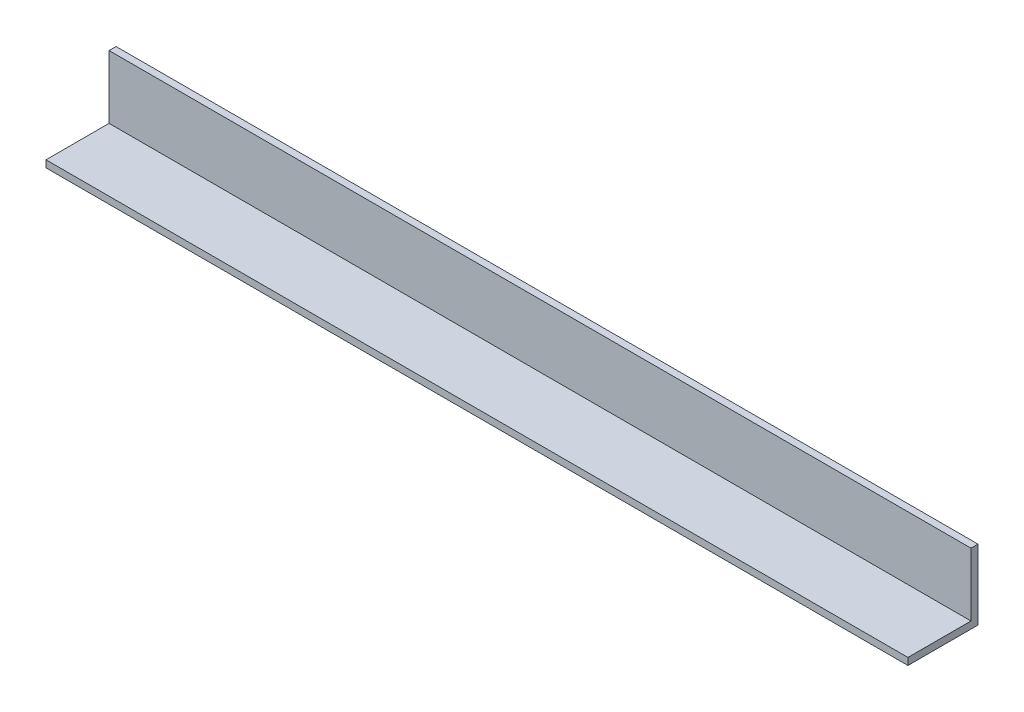
from build123d import *

# Parameters (mm, degrees)
BOSS_EXTRUDE1_DEPTH = 246


with BuildPart() as part:
    # Sketch1 → Boss-Extrude1 (new body)
    with BuildSketch(Plane(origin=(0, 0, 0), x_dir=(0, 0, -1), z_dir=(1, 0, 0))):
        Polygon((0, 20), (0, 0), (-20, 0), (-20, 2), (-2, 2), (-2, 20), align=None)
    extrude(amount=BOSS_EXTRUDE1_DEPTH)


solid = part.part
